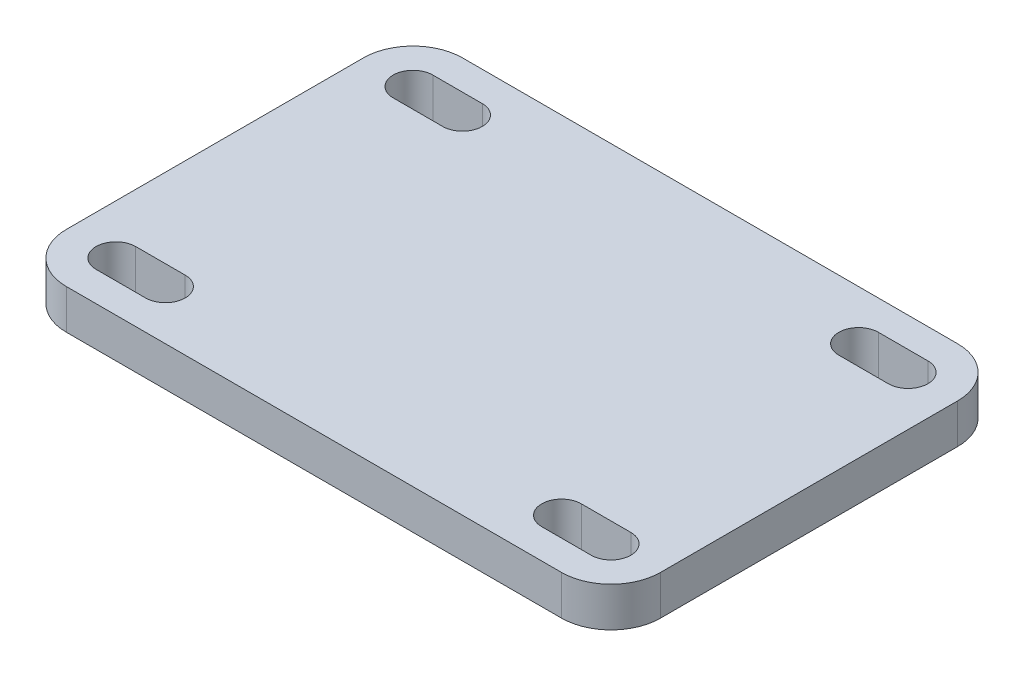
from build123d import *

# Parameters (mm, degrees)
BOSS_EXTRUDE1_DEPTH = 4
CUT_EXTRUDE1_DEPTH  = 4


with BuildPart() as part:
    # Sketch1 → Boss-Extrude1 (new body)
    with BuildSketch(Plane(origin=(0, 0, 0), x_dir=(1, 0, 0), z_dir=(0, 1, 0))):
        with BuildLine():
            Line((25, -20), (-25, -20))
            ThreePointArc((-25, -20), (-28.535533906, -18.535533906), (-30, -15))
            Line((-30, -15), (-30, 15))
            ThreePointArc((-30, 15), (-28.535533906, 18.535533906), (-25, 20))
            Line((-25, 20), (25, 20))
            ThreePointArc((25, 20), (28.535533906, 18.535533906), (30, 15))
            Line((30, 15), (30, -15))
            ThreePointArc((30, -15), (28.535533906, -18.535533906), (25, -20))
        make_face()
    extrude(amount=BOSS_EXTRUDE1_DEPTH)

    # Sketch2 → Cut-Extrude1 (cut)
    with BuildSketch(Plane(origin=(0, 4, 0), x_dir=(1, 0, 0), z_dir=(0, 1, 0))):
        with BuildLine():
            Line((-25, 17), (-20, 17))
            ThreePointArc((-20, 17), (-18, 15), (-20, 13))
            Line((-20, 13), (-25, 13))
            ThreePointArc((-25, 13), (-27, 15), (-25, 17))
        make_face()
        with BuildLine():
            Line((25, 17), (20, 17))
            ThreePointArc((20, 17), (18, 15), (20, 13))
            Line((20, 13), (25, 13))
            ThreePointArc((25, 13), (27, 15), (25, 17))
        make_face()
        with BuildLine():
            Line((25, -17), (20, -17))
            ThreePointArc((20, -17), (18, -15), (20, -13))
            Line((20, -13), (25, -13))
            ThreePointArc((25, -13), (27, -15), (25, -17))
        make_face()
        with BuildLine():
            Line((-25, -17), (-20, -17))
            ThreePointArc((-20, -17), (-18, -15), (-20, -13))
            Line((-20, -13), (-25, -13))
            ThreePointArc((-25, -13), (-27, -15), (-25, -17))
        make_face()
    extrude(amount=-CUT_EXTRUDE1_DEPTH, mode=Mode.SUBTRACT)


solid = part.part
